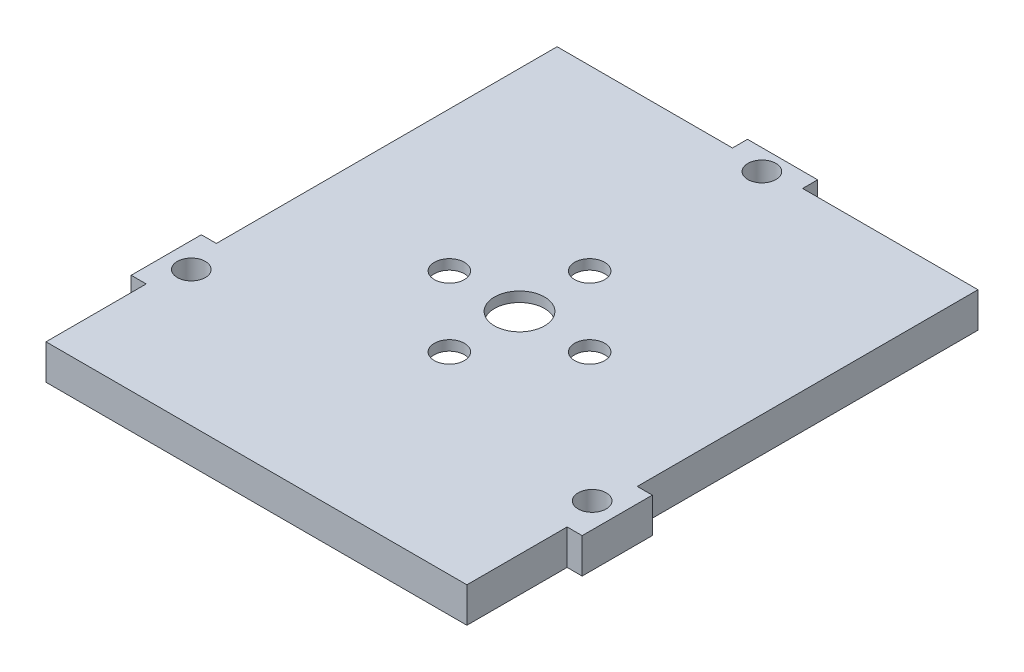
from build123d import *

# Parameters (mm, degrees)
SKETCH1_W           = 42
SKETCH1_H           = 51
BOSS_EXTRUDE1_DEPTH = 3.5
SKETCH2_W           = 7
SKETCH2_H           = 3.5
BOSS_EXTRUDE2_DEPTH = 1.5
SKETCH3_W           = 7
SKETCH3_H           = 3.5
BOSS_EXTRUDE3_DEPTH = 1.5
SKETCH5_W           = 7
SKETCH5_H           = 3.5
BOSS_EXTRUDE4_DEPTH = 1.5
SKETCH4_R           = 1.4
CUT_EXTRUDE1_DEPTH  = 5
SKETCH6_R           = 1.5
SKETCH6_R_2         = 2.5
CUT_EXTRUDE2_DEPTH  = 2.5
SKETCH7_W           = 25
SKETCH7_H           = 25
CUT_EXTRUDE3_DEPTH  = 2.5


with BuildPart() as part:
    # Sketch1 → Boss-Extrude1 (new body)
    with BuildSketch(Plane(origin=(0, 0, 0), x_dir=(1, 0, 0), z_dir=(0, 1, 0))):
        Rectangle(SKETCH1_W, SKETCH1_H)
    extrude(amount=BOSS_EXTRUDE1_DEPTH)

    # Sketch2 → Boss-Extrude2 (add)
    with BuildSketch(Plane.ZY.offset(21)):
        with Locations((12, 1.75)):
            Rectangle(SKETCH2_W, SKETCH2_H)
    extrude(amount=BOSS_EXTRUDE2_DEPTH)

    # Sketch3 → Boss-Extrude3 (add)
    with BuildSketch(Plane(origin=(21, 0, 0), x_dir=(0, 0, -1), z_dir=(1, 0, 0))):
        with Locations((-12, 1.75)):
            Rectangle(SKETCH3_W, SKETCH3_H)
    extrude(amount=BOSS_EXTRUDE3_DEPTH)

    # Sketch5 → Boss-Extrude4 (add)
    with BuildSketch(Plane(origin=(0, 0, -25.5), x_dir=(-1, 0, 0), z_dir=(0, 0, -1))):
        with Locations((0, 1.75)):
            Rectangle(SKETCH5_W, SKETCH5_H)
    extrude(amount=BOSS_EXTRUDE4_DEPTH)

    # Sketch4 → Cut-Extrude1 (cut)
    with BuildSketch(Plane(origin=(0, 3.5, 0), x_dir=(1, 0, 0), z_dir=(0, 1, 0))):
        with Locations(Location((-20, -12, 0), (0, 0, 270))):
            Circle(SKETCH4_R)
        with Locations(Location((20, -12, 0), (0, 0, 270))):
            Circle(SKETCH4_R)
        with Locations(Location((0, 24.9375, 0), (0, 0, 270))):
            Circle(SKETCH4_R)
    extrude(amount=-CUT_EXTRUDE1_DEPTH, mode=Mode.SUBTRACT)

    # Sketch6 → Cut-Extrude2 (cut)
    with BuildSketch(Plane(origin=(0, 3.5, 0), x_dir=(1, 0, 0), z_dir=(0, 1, 0))):
        with Locations(Location((-7, 0.75, 0), (0, 0, 270))):
            Circle(SKETCH6_R)
        with Locations(Location((0, 7.75, 0), (0, 0, 270))):
            Circle(SKETCH6_R)
        with Locations(Location((7, 0.75, 0), (0, 0, 90))):
            Circle(SKETCH6_R)
        with Locations(Location((0, -6.25, 0), (0, 0, 90))):
            Circle(SKETCH6_R)
        with Locations(Location((0, 0.75, 0), (0, 0, 270))):
            Circle(SKETCH6_R_2)
    extrude(amount=-CUT_EXTRUDE2_DEPTH, mode=Mode.SUBTRACT)

    # Sketch7 → Cut-Extrude3 (cut)
    with BuildSketch(Plane.XZ):
        with Locations((0, -0.75)):
            Rectangle(SKETCH7_W, SKETCH7_H)
    extrude(amount=-CUT_EXTRUDE3_DEPTH, mode=Mode.SUBTRACT)


solid = part.part
